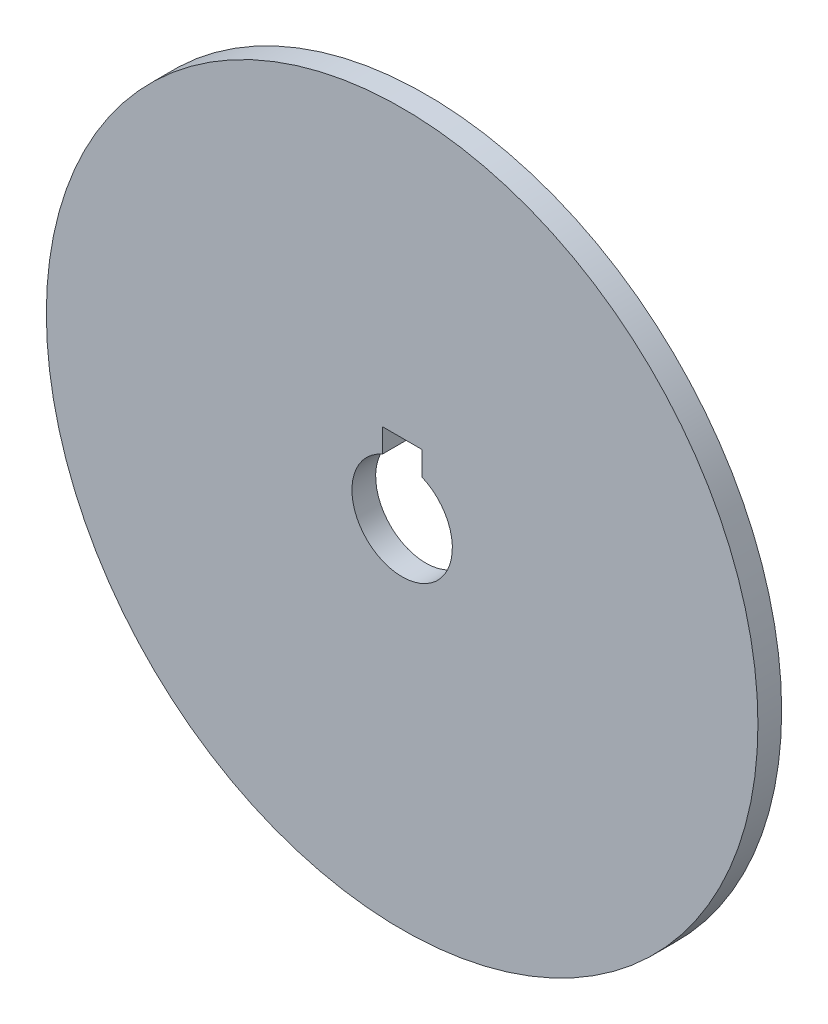
from build123d import *

# Parameters (mm, degrees)
CROQUIS1_R              = 45
SALIENTE_EXTRUIR1_DEPTH = 3


with BuildPart() as part:
    # Croquis1 → Saliente-Extruir1 (new body)
    with BuildSketch(Plane.XY):
        Circle(CROQUIS1_R)
        with BuildLine():
            Line((2.5, 5.837165408), (2.5, 8.85))
            Line((2.5, 8.85), (-2.5, 8.85))
            Line((-2.5, 8.85), (-2.5, 5.837165408))
            ThreePointArc((-2.5, 5.837165408), (0, -6.35), (2.5, 5.837165408))
        make_face(mode=Mode.SUBTRACT)
    extrude(amount=SALIENTE_EXTRUIR1_DEPTH)


solid = part.part
